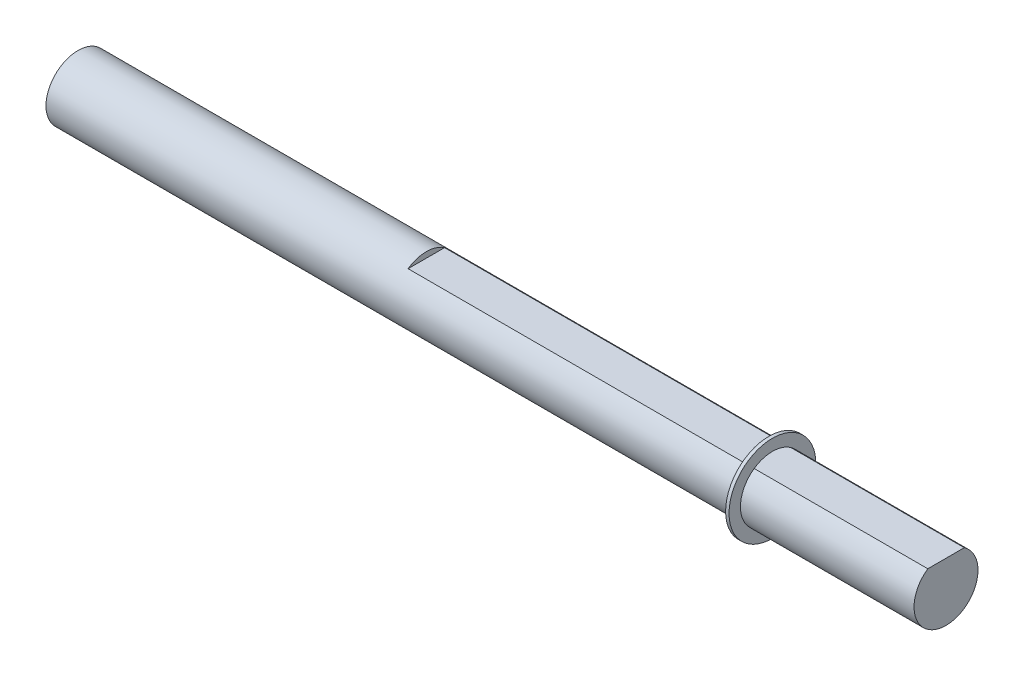
from build123d import *

# Parameters (mm, degrees)
ENL_V_START             = -45.5
ENL_V_MAT_EXTRU_1_DEPTH = 45.5


with BuildPart() as part:
    # Esquisse1 → Révolution1 (revolve)
    with BuildSketch(Plane.XY, mode=Mode.PRIVATE) as r_volution1_sk:
        Polygon((60.8, 2.8), (60.8, 3.8), (60.5, 3.8), (60.5, 2.8), (0, 2.8), (0, 0), (76, 0), (76, 2.8), align=None)
    revolve(r_volution1_sk.sketch.rotate(Axis((0, 0, 0), (1, 0, 0)), 90), axis=Axis((0, 0, 0), (1, 0, 0)))

    # Esquisse2 → Enlèv. mat.-Extru.1 (cut)
    with BuildSketch(Plane(origin=(76, 0, 0), x_dir=(0, 0, -1), z_dir=(1, 0, 0)).offset(ENL_V_START)):
        with BuildLine():
            Line((-1.596871942, 2.3), (1.596871942, 2.3))
            ThreePointArc((1.596871942, 2.3), (0, 2.8), (-1.596871942, 2.3))
        make_face()
    extrude(amount=ENL_V_MAT_EXTRU_1_DEPTH, mode=Mode.SUBTRACT)


solid = part.part
